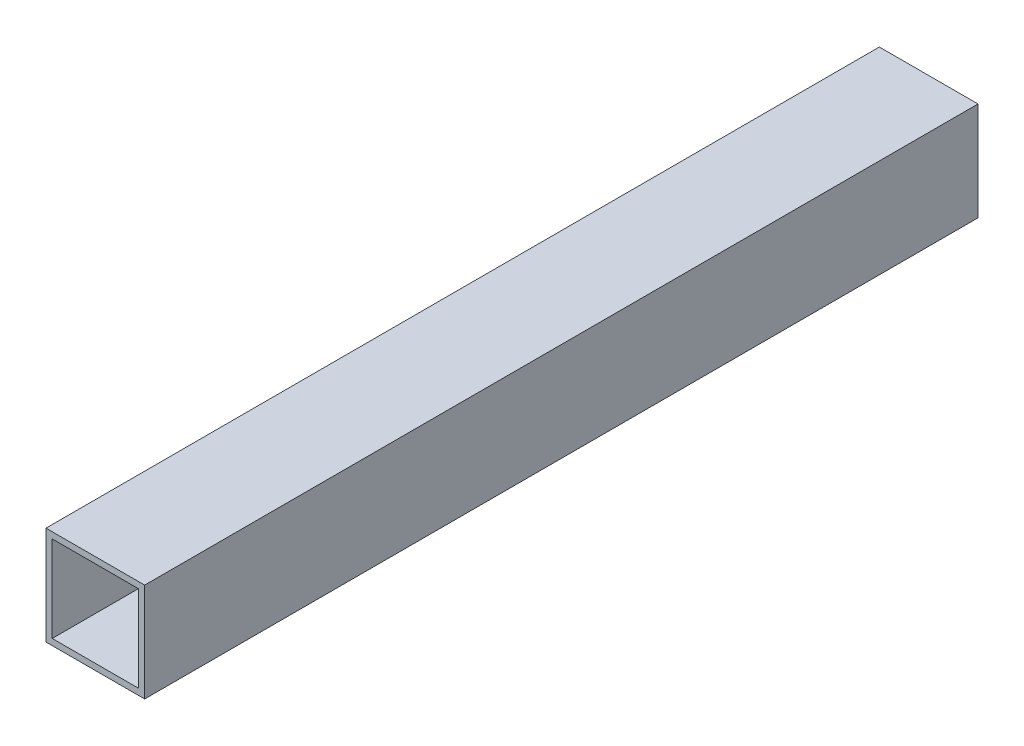
from build123d import *

# Parameters (mm, degrees)
SKETCH1_W           = 19
SKETCH1_H           = 19
SKETCH1_W_2         = 16.6
SKETCH1_H_2         = 16.6
BOSS_EXTRUDE1_DEPTH = 80.25


with BuildPart() as part:
    # Sketch1 → Boss-Extrude1 (new, symmetric)
    with BuildSketch(Plane.XY):
        Rectangle(SKETCH1_W, SKETCH1_H)
        Rectangle(SKETCH1_W_2, SKETCH1_H_2, mode=Mode.SUBTRACT)
    extrude(amount=BOSS_EXTRUDE1_DEPTH, both=True)


solid = part.part
